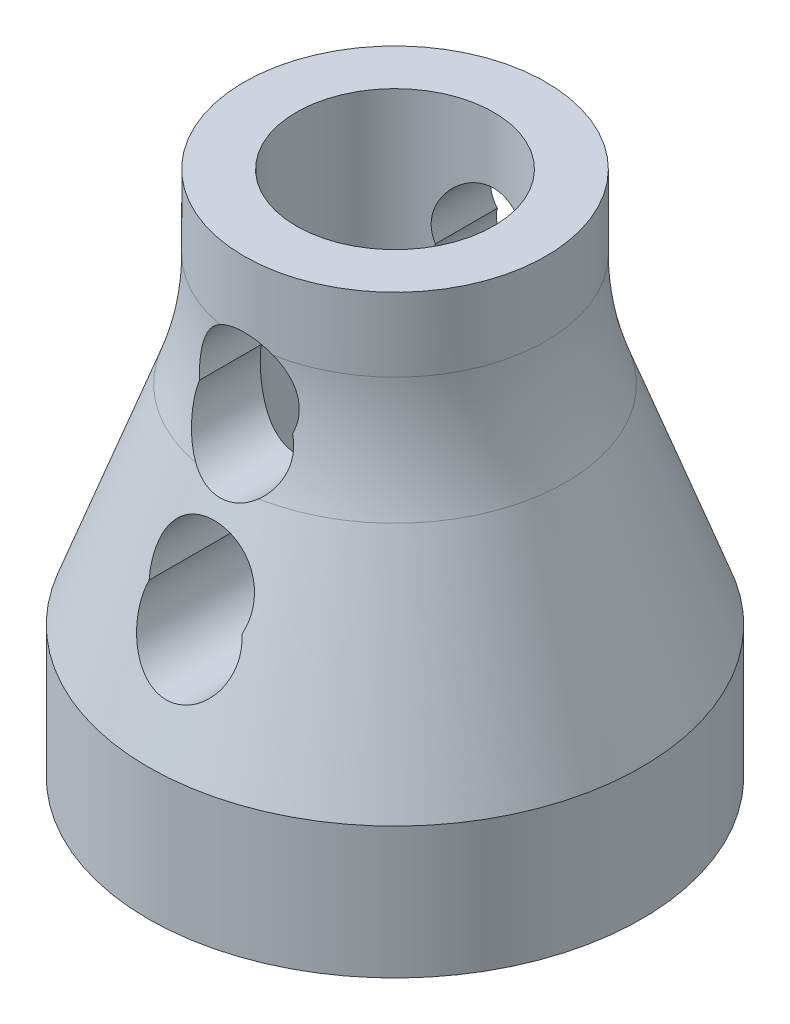
from build123d import *

# Parameters (mm, degrees)
SKETCH1_R           = 7.5
BOSS_EXTRUDE1_DEPTH = 4
SKETCH4_R           = 7.5
BOSS_EXTRUDE4_DEPTH = 8
BOSS_EXTRUDE4_TAPER = 20
SKETCH5_R           = 1.5
CUT_EXTRUDE2_DEPTH  = 17.015617547
SKETCH6_R           = 3
CUT_EXTRUDE3_DEPTH  = 9
SKETCH7_R           = 1.5
CUT_EXTRUDE4_DEPTH  = 23.505555034
SKETCH8_R           = 1.5
CUT_EXTRUDE5_DEPTH  = 23.505555034
BOSS_EXTRUDE5_START = 4
SKETCH9_R           = 4.588238126
SKETCH9_R_2         = 3
BOSS_EXTRUDE5_DEPTH = 4
FILLET1_R           = 10
SKETCH10_R          = 1.5
CUT_EXTRUDE6_DEPTH  = 25.869660396


with BuildPart() as part:
    # Sketch1 → Boss-Extrude1 (new body)
    with BuildSketch(Plane(origin=(0, 0, 0), x_dir=(1, 0, 0), z_dir=(0, 1, 0))):
        with Locations(Location((0, 0, 0), (0, 0, 270))):
            Circle(SKETCH1_R)
    extrude(amount=BOSS_EXTRUDE1_DEPTH)

    # Sketch4 → Boss-Extrude4 (add)
    with BuildSketch(Plane(origin=(0, 4, 0), x_dir=(1, 0, 0), z_dir=(0, 1, 0))):
        with Locations(Location((0, 0, 0), (0, 0, 270))):
            Circle(SKETCH4_R)
    extrude(amount=BOSS_EXTRUDE4_DEPTH, taper=BOSS_EXTRUDE4_TAPER)

    # Sketch5 → Cut-Extrude2 (cut, through all)
    with BuildSketch(Plane(origin=(0, 0, 0), x_dir=(-1, 0, 0), z_dir=(0, -1, 0))):
        with Locations(Location((0, 0, 0), (0, 0, 90))):
            Circle(SKETCH5_R)
    extrude(amount=-CUT_EXTRUDE2_DEPTH, mode=Mode.SUBTRACT)

    # Sketch6 → Cut-Extrude3 (cut)
    with BuildSketch(Plane(origin=(0, 12, 0), x_dir=(1, 0, 0), z_dir=(0, 1, 0))):
        with Locations(Location((0, 0, 0), (0, 0, 270))):
            Circle(SKETCH6_R)
    extrude(amount=-CUT_EXTRUDE3_DEPTH, mode=Mode.SUBTRACT)

    # Sketch7 → Cut-Extrude4 (cut, through all)
    with BuildSketch(Plane.XY.offset(10)):
        with Locations((0, 8)):
            Circle(SKETCH7_R)
    extrude(amount=-CUT_EXTRUDE4_DEPTH, mode=Mode.SUBTRACT)

    # Sketch8 → Cut-Extrude5 (cut, through all)
    with BuildSketch(Plane.XY.offset(10)):
        with Locations((0, 7)):
            Circle(SKETCH8_R)
    extrude(amount=-CUT_EXTRUDE5_DEPTH, mode=Mode.SUBTRACT)

    # Sketch9 → Boss-Extrude5 (add)
    with BuildSketch(Plane(origin=(0, 12, 0), x_dir=(1, 0, 0), z_dir=(0, 1, 0)).offset(BOSS_EXTRUDE5_START)):
        with Locations(Location((0, 0, 0), (0, 0, 270))):
            Circle(SKETCH9_R)
        with Locations(Location((0, 0, 0), (0, 0, 270))):
            Circle(SKETCH9_R_2, mode=Mode.SUBTRACT)
    extrude(amount=-BOSS_EXTRUDE5_DEPTH)

    # Fillet1
    fillet1_edges = [part.edges().sort_by_distance(p)[0] for p in [
        (0, 12, -4.588238126),
    ]]
    fillet(fillet1_edges, radius=FILLET1_R)

    # Sketch10 → Cut-Extrude6 (cut, through all)
    with BuildSketch(Plane.XY.offset(10)):
        with Locations((0, 11.5)):
            Circle(SKETCH10_R)
        with Locations((0, 12.5)):
            Circle(SKETCH10_R)
    extrude(amount=-CUT_EXTRUDE6_DEPTH, mode=Mode.SUBTRACT)


solid = part.part
